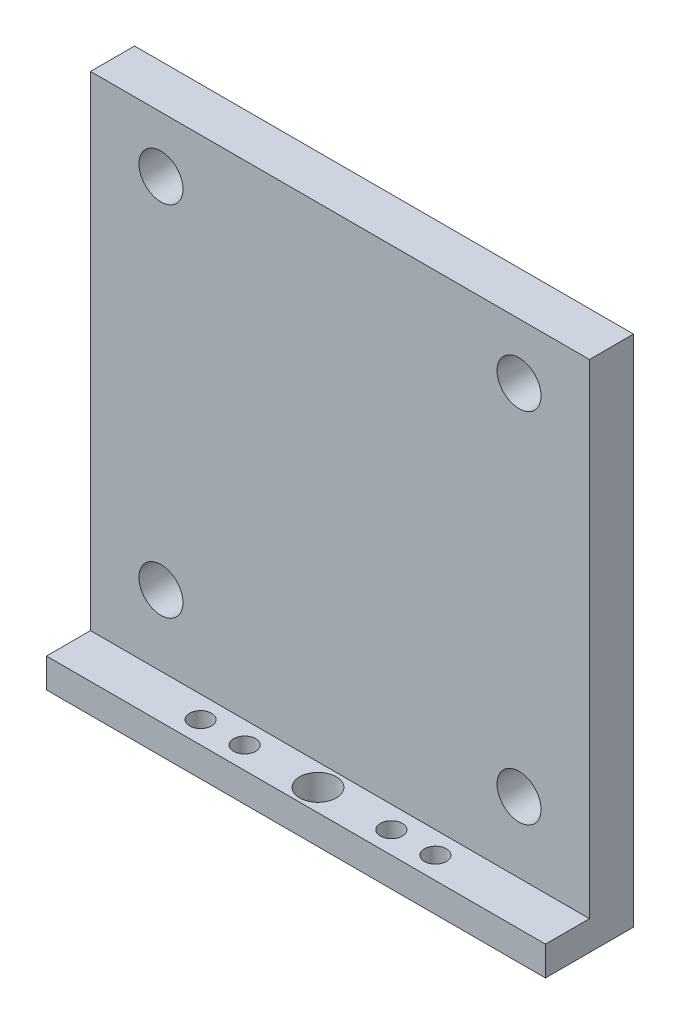
from build123d import *

# Parameters (mm, degrees)
BOSS_EXTRUDE1_DEPTH = 34
SKETCH2_R           = 1.5
CUT_EXTRUDE1_DEPTH  = 49.887626246
SKETCH3_R           = 1.25
SKETCH3_R_2         = 0.75
CUT_EXTRUDE2_DEPTH  = 48.759815745


with BuildPart() as part:
    # Sketch1 → Boss-Extrude1 (new body)
    with BuildSketch(Plane(origin=(0, 0, 0), x_dir=(0, 0, -1), z_dir=(1, 0, 0))):
        Polygon((0, 0), (6, 0), (6, 35), (3, 35), (3, 2), (0, 2), align=None)
    extrude(amount=BOSS_EXTRUDE1_DEPTH)

    # Sketch2 → Cut-Extrude1 (cut, through all)
    with BuildSketch(Plane.XY.offset(-3)):
        with Locations((29.2, 31.2)):
            Circle(SKETCH2_R)
        with Locations((4.8, 31.2)):
            Circle(SKETCH2_R)
        with Locations((4.8, 6.8)):
            Circle(SKETCH2_R)
        with Locations((29.2, 6.8)):
            Circle(SKETCH2_R)
    extrude(amount=-CUT_EXTRUDE1_DEPTH, mode=Mode.SUBTRACT)

    # Sketch3 → Cut-Extrude2 (cut, through all)
    with BuildSketch(Plane(origin=(0, 2, 0), x_dir=(1, 0, 0), z_dir=(0, 1, 0))):
        with Locations(Location((17, 1.5, 0), (0, 0, 270))):
            Circle(SKETCH3_R)
        with Locations(Location((22, 1.5, 0), (0, 0, 270))):
            Circle(SKETCH3_R_2)
        with Locations(Location((25, 1.5, 0), (0, 0, 270))):
            Circle(SKETCH3_R_2)
        with Locations(Location((12, 1.5, 0), (0, 0, 270))):
            Circle(SKETCH3_R_2)
        with Locations(Location((9, 1.5, 0), (0, 0, 270))):
            Circle(SKETCH3_R_2)
    extrude(amount=-CUT_EXTRUDE2_DEPTH, mode=Mode.SUBTRACT)


solid = part.part
